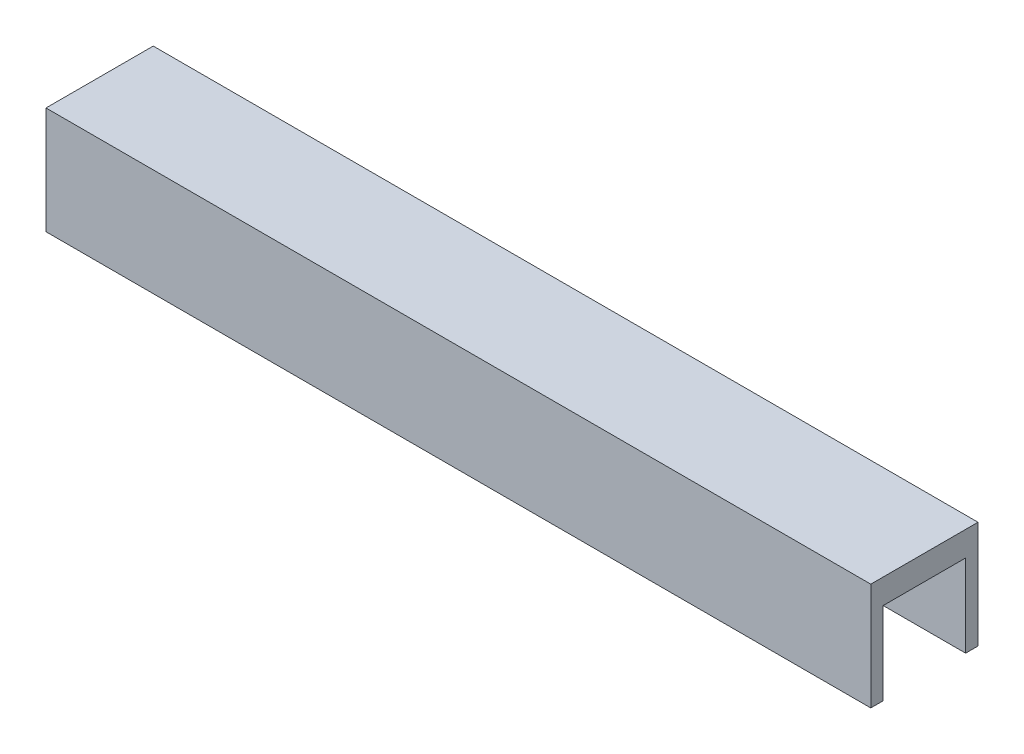
from build123d import *

# Parameters (mm, degrees)
SKETCH1_W           = 100
SKETCH1_H           = 13
BOSS_EXTRUDE1_DEPTH = 13
SKETCH2_W           = 100
SKETCH2_H           = 10
CUT_EXTRUDE1_DEPTH  = 13


with BuildPart() as part:
    # Sketch1 → Boss-Extrude1 (new body)
    with BuildSketch(Plane(origin=(0, 0, 0), x_dir=(1, 0, 0), z_dir=(0, 1, 0))):
        Rectangle(SKETCH1_W, SKETCH1_H)
    extrude(amount=BOSS_EXTRUDE1_DEPTH)

    # Sketch2 → Cut-Extrude1 (cut)
    with BuildSketch(Plane(origin=(0, 10, 0), x_dir=(1, 0, 0), z_dir=(0, 1, 0))):
        Rectangle(SKETCH2_W, SKETCH2_H)
    extrude(amount=-CUT_EXTRUDE1_DEPTH, mode=Mode.SUBTRACT)


solid = part.part
